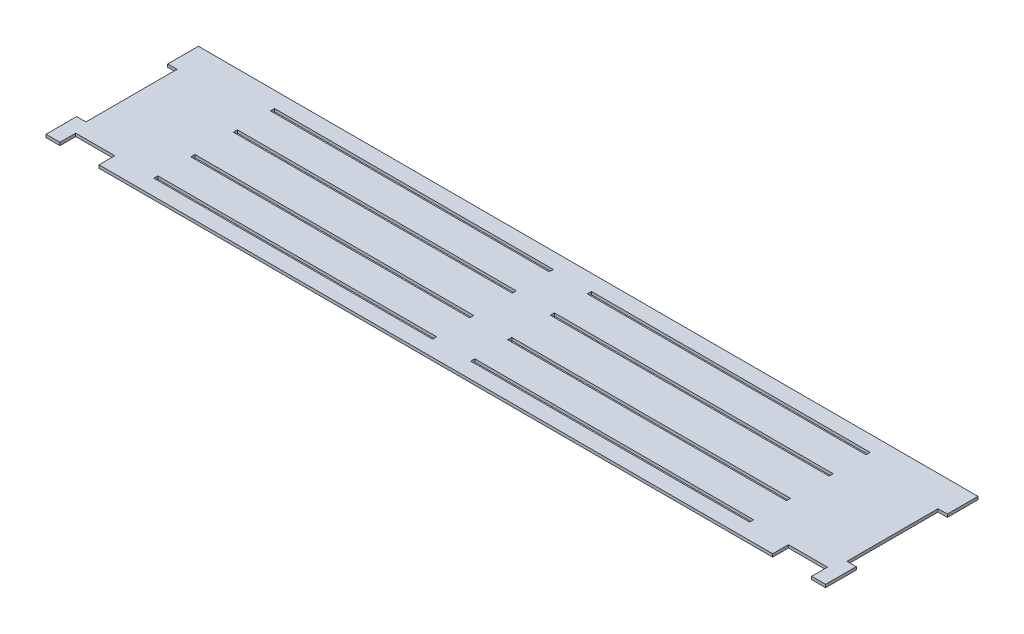
from build123d import *

# Parameters (mm, degrees)
ESQUISSE1_W                = 419.5
ESQUISSE1_H                = 82
BOSS_EXTRU_1_DEPTH         = 1.5875
ESQUISSE2_W                = 5
ESQUISSE2_H                = 49
ENL_V_MAT_EXTRU_1_DEPTH    = 214.72548434
ENL_V_MAT_EXTRU_2_DEPTH    = 214.72548434
R_P_TITION_LIN_AIRE1_COUNT = 2
R_P_TITION_LIN_AIRE1_PITCH = 19.921
SYM_TRIE5_COPY_1_DEPTH     = 214.72548434
ENL_V_MAT_EXTRU_3_REACH    = 215.725
ESQUISSE5_W                = 21
ESQUISSE5_H                = 8.5
SYM_TRIE6_COPY_1_DEPTH     = 214.72548434
SYM_TRIE6_COPY_2_DEPTH     = 214.72548434
SYM_TRIE6_COPY_3_DEPTH     = 214.72548434


with BuildPart() as part:
    # Esquisse1 → Boss.-Extru.1 (new body)
    with BuildSketch(Plane(origin=(0, 0, 0), x_dir=(1, 0, 0), z_dir=(0, 1, 0))):
        Rectangle(ESQUISSE1_W, ESQUISSE1_H)
    extrude(amount=BOSS_EXTRU_1_DEPTH)

    # Esquisse2 → Enlèv. mat.-Extru.1 (cut, through all)
    with BuildSketch(Plane(origin=(0, 1.5875, 0), x_dir=(1, 0, 0), z_dir=(0, 1, 0))):
        with Locations((-207.25, 0)):
            Rectangle(ESQUISSE2_W, ESQUISSE2_H)
    enl_v_mat_extru_1 = extrude(amount=-ENL_V_MAT_EXTRU_1_DEPTH, mode=Mode.SUBTRACT)

    # Symétrie1: Enlèv. mat.-Extru.1 across plane
    add(enl_v_mat_extru_1.mirror(Plane(origin=(0, 0, 0), x_dir=(0, 0, 1), z_dir=(1, 0, 0))), mode=Mode.SUBTRACT)

    # Esquisse3 → Enlèv. mat.-Extru.2 (cut, through all)
    with BuildSketch(Plane(origin=(0, 1.5875, 0), x_dir=(1, 0, 0), z_dir=(0, 1, 0))):
        Polygon((10.25, 32.4815), (160.25, 32.481498288), (160.25, 30.281498288), (10.25, 30.2815), align=None)
    enl_v_mat_extru_2 = extrude(amount=-ENL_V_MAT_EXTRU_2_DEPTH, mode=Mode.SUBTRACT)

    # Répétition linéaire1: Enlèv. mat.-Extru.2 ×2
    with Locations(*[(0, 0, i * R_P_TITION_LIN_AIRE1_PITCH) for i in range(1, R_P_TITION_LIN_AIRE1_COUNT)]):
        add(enl_v_mat_extru_2, mode=Mode.SUBTRACT)

    # Symétrie5: Enlèv. mat.-Extru.2 across plane
    add(enl_v_mat_extru_2.mirror(Plane(origin=(0, 0, 0), x_dir=(0, 0, 1), z_dir=(1, 0, 0))), mode=Mode.SUBTRACT)

    # Symétrie5 copy 1 sketch → Symétrie5 copy 1 (cut, through all)
    with BuildSketch(Plane(origin=(0, 1.5875, 19.921), x_dir=(-1, 0, 0), z_dir=(0, 1, 0))):
        Polygon((10.25, -32.4815), (160.25, -32.481498288), (160.25, -30.281498288), (10.25, -30.2815), align=None)
    extrude(amount=-SYM_TRIE5_COPY_1_DEPTH, mode=Mode.SUBTRACT)

    # Esquisse5 → Enlèv. mat.-Extru.3 (cut, up to next)
    with BuildSketch(Plane.XZ, mode=Mode.PRIVATE) as enl_v_mat_extru_3_sk1:
        with Locations((191.75, 36.75)):
            Rectangle(ESQUISSE5_W, ESQUISSE5_H)
    enl_v_mat_extru_3_tool1 = extrude(enl_v_mat_extru_3_sk1.sketch, amount=-ENL_V_MAT_EXTRU_3_REACH, mode=Mode.PRIVATE) & part.part
    # Esquisse5 → Enlèv. mat.-Extru.3 (cut, up to next)
    with BuildSketch(Plane.XZ, mode=Mode.PRIVATE) as enl_v_mat_extru_3_sk2:
        with Locations((-191.75, 36.75)):
            Rectangle(ESQUISSE5_W, ESQUISSE5_H)
    enl_v_mat_extru_3_tool2 = extrude(enl_v_mat_extru_3_sk2.sketch, amount=-ENL_V_MAT_EXTRU_3_REACH, mode=Mode.PRIVATE) & part.part
    add(enl_v_mat_extru_3_tool1.solids().sort_by_distance((191.75, 0, 36.75))[0], mode=Mode.SUBTRACT)
    add(enl_v_mat_extru_3_tool2.solids().sort_by_distance((-191.75, 0, 36.75))[0], mode=Mode.SUBTRACT)

    # Symétrie6: Enlèv. mat.-Extru.2 across plane
    add(enl_v_mat_extru_2.mirror(Plane.XY), mode=Mode.SUBTRACT)

    # Symétrie6 copy 1 sketch → Symétrie6 copy 1 (cut, through all)
    with BuildSketch(Plane(origin=(0, 1.5875, -19.921), x_dir=(1, 0, 0), z_dir=(0, 1, 0))):
        Polygon((10.25, -32.4815), (160.25, -32.481498288), (160.25, -30.281498288), (10.25, -30.2815), align=None)
    extrude(amount=-SYM_TRIE6_COPY_1_DEPTH, mode=Mode.SUBTRACT)

    # Symétrie6 copy 2 sketch → Symétrie6 copy 2 (cut, through all)
    with BuildSketch(Plane(origin=(0, 1.5875, 0), x_dir=(-1, 0, 0), z_dir=(0, 1, 0))):
        Polygon((10.25, 32.4815), (160.25, 32.481498288), (160.25, 30.281498288), (10.25, 30.2815), align=None)
    extrude(amount=-SYM_TRIE6_COPY_2_DEPTH, mode=Mode.SUBTRACT)

    # Symétrie6 copy 3 sketch → Symétrie6 copy 3 (cut, through all)
    with BuildSketch(Plane(origin=(0, 1.5875, -19.921), x_dir=(-1, 0, 0), z_dir=(0, 1, 0))):
        Polygon((10.25, 32.4815), (160.25, 32.481498288), (160.25, 30.281498288), (10.25, 30.2815), align=None)
    extrude(amount=-SYM_TRIE6_COPY_3_DEPTH, mode=Mode.SUBTRACT)


solid = part.part
